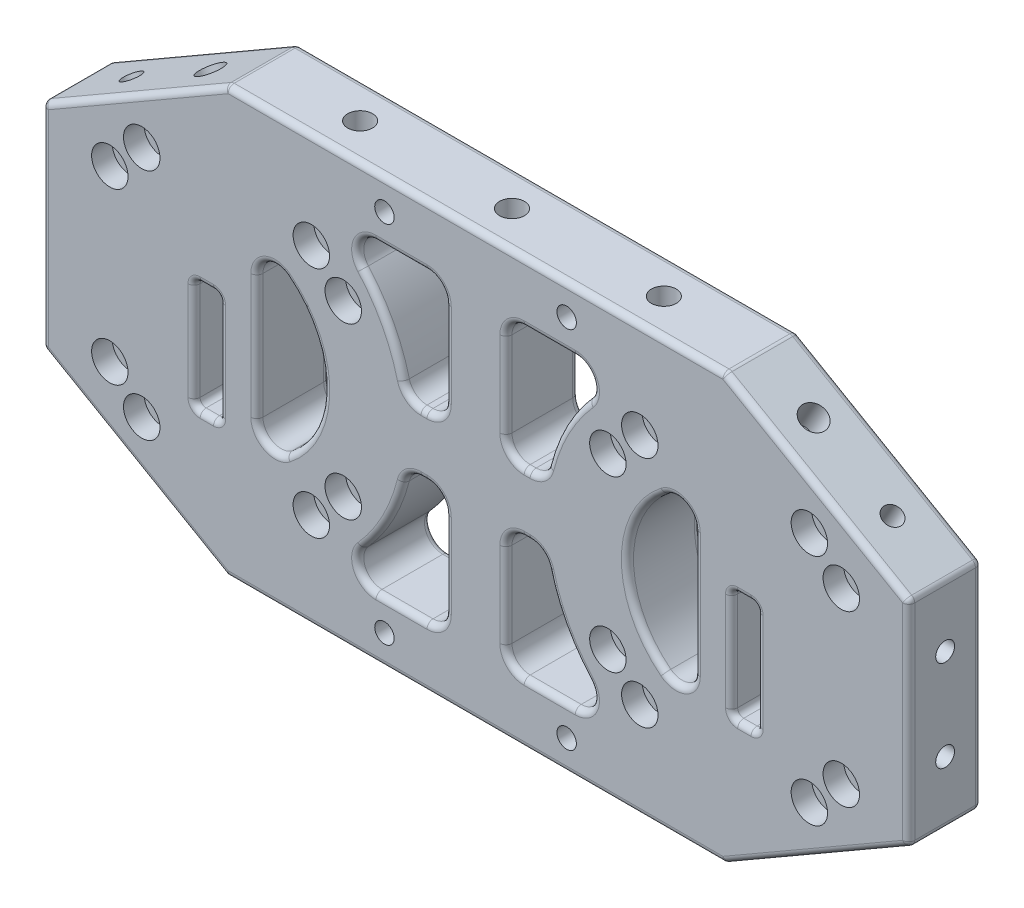
from build123d import *

# Parameters (mm, degrees)
SKETCH_1_W                   = 4.2
SKETCH_1_H                   = 18.2
EXTRUDE_1_DEPTH              = 12
FILLET_2_R                   = 3
SKETCH_2_R                   = 1.55
CUT_EXTRUDE_1_DEPTH          = 5
SKETCH_3_R                   = 1.55
CUT_EXTRUDE_2_DEPTH          = 5
SKETCH_4_R                   = 1.55
CUT_EXTRUDE_3_DEPTH          = 5
SKETCH_5_R                   = 1.55
CUT_EXTRUDE_4_DEPTH          = 5
SKETCH_6_R                   = 1.55
CUT_EXTRUDE_5_DEPTH          = 5
SKETCH_7_R                   = 2.05
CUT_EXTRUDE_6_DEPTH          = 5
CUT_EXTRUDE_START            = -5
SKETCH_8_R                   = 2.05
CUT_EXTRUDE_7_DEPTH          = 5
SKETCH_9_R                   = 1.55
CUT_EXTRUDE_8_DEPTH          = 5
SKETCH_10_R                  = 2.05
CUT_EXTRUDE_9_DEPTH          = 5
SKETCH_11_R                  = 2.05
CUT_EXTRUDE_10_DEPTH         = 5
FILLET_3_R                   = 1
HOLE_WIZARD_M3_1_D           = 3.2
HOLE_WIZARD_M3_1_CBORE_D     = 6
HOLE_WIZARD_M3_1_CBORE_DEPTH = 3.4
HOLE_WIZARD_M3_2_D           = 3.2
HOLE_WIZARD_M3_2_CBORE_D     = 6
HOLE_WIZARD_M3_2_CBORE_DEPTH = 3.4


with BuildPart() as part:
    # 草图1 → 凸台-拉伸1 (new body)
    with BuildSketch(Plane.XY):
        Polygon((0, 0), (41, 0), (41, 70), (0, 70), (-30.310889132, 52.5), (-30.310889132, 17.5), align=None)
        with BuildLine():
            Line((36, 40), (36, 60))
            Line((36, 60), (16.583123952, 60))
            ThreePointArc((16.583123952, 60), (25.154874495, 51.347241025), (29.580398915, 40))
            Line((29.580398915, 40), (36, 40))
        make_face(mode=Mode.SUBTRACT)
        with BuildLine():
            Line((36, 30), (36, 10))
            Line((36, 10), (16.583123952, 10))
            ThreePointArc((16.583123952, 10), (25.154874495, 18.652758975), (29.580398915, 30))
            Line((29.580398915, 30), (36, 30))
        make_face(mode=Mode.SUBTRACT)
        with BuildLine():
            Line((5, 50.198684154), (5, 19.801315846))
            ThreePointArc((5, 19.801315846), (16, 35), (5, 50.198684154))
        make_face(mode=Mode.SUBTRACT)
        with Locations((-3.25, 30.5)):
            Rectangle(SKETCH_1_W, SKETCH_1_H, mode=Mode.SUBTRACT)
    extrude_1 = extrude(amount=EXTRUDE_1_DEPTH)

    # 镜向2: 凸台-拉伸1 across plane
    add(extrude_1.mirror(Plane(origin=(41, 70, 12), x_dir=(0, 0, 1), z_dir=(-1, 0, 0))))

    # 圆角2
    fillet_2_edges = [part.edges().sort_by_distance(p)[0] for p in [
        (29.580398915, 40, 6),
        (36, 40, 6),
        (36, 60, 6),
        (16.583123952, 60, 6),
        (5, 19.801315846, 6),
        (5, 50.198684154, 6),
        (36, 30, 6),
        (29.580398915, 30, 6),
        (16.583123952, 10, 6),
        (36, 10, 6),
        (52.419601085, 40, 6),
        (65.416876048, 60, 6),
        (46, 60, 6),
        (46, 40, 6),
        (77, 19.801315846, 6),
        (77, 50.198684154, 6),
        (46, 30, 6),
        (46, 10, 6),
        (65.416876048, 10, 6),
        (52.419601085, 30, 6),
    ]]
    fillet(fillet_2_edges, radius=FILLET_2_R)

    # 草图2 → 切除-拉伸1 (cut)
    with BuildSketch(Plane(origin=(-30.310889132, 52.5, 0), x_dir=(0.866025403784438, 0.5000000000000012, 0), z_dir=(-0.5000000000000011, 0.8660254037844379, 0))):
        with Locations(Location((10, -6, 0), (0, 0, 180))):
            Circle(SKETCH_2_R)
        with Locations(Location((25, -6, 0), (0, 0, 180))):
            Circle(SKETCH_2_R)
    extrude(amount=-CUT_EXTRUDE_1_DEPTH, mode=Mode.SUBTRACT)

    # 草图3 → 切除-拉伸2 (cut)
    with BuildSketch(Plane(origin=(50.810889132, 88.007041555, 0), x_dir=(0.866025403784438, -0.5000000000000012, 0), z_dir=(0.5000000000000011, 0.8660254037844379, 0))):
        with Locations(Location((61.01408311, -6, 0), (0, 0, 180))):
            Circle(SKETCH_3_R)
        with Locations(Location((46.01408311, -6, 0), (0, 0, 180))):
            Circle(SKETCH_3_R)
    extrude(amount=-CUT_EXTRUDE_2_DEPTH, mode=Mode.SUBTRACT)

    # 草图4 → 切除-拉伸3 (cut)
    with BuildSketch(Plane(origin=(0, 0, 0), x_dir=(0.8660254037844397, -0.4999999999999982, 0), z_dir=(-0.4999999999999983, -0.8660254037844398, 0))):
        with Locations((-10, 6)):
            Circle(SKETCH_4_R)
        with Locations((-25, 6)):
            Circle(SKETCH_4_R)
    extrude(amount=-CUT_EXTRUDE_3_DEPTH, mode=Mode.SUBTRACT)

    # 草图5 → 切除-拉伸4 (cut)
    with BuildSketch(Plane(origin=(20.5, -35.507041555, 0), x_dir=(0.8660254037844397, 0.4999999999999982, 0), z_dir=(0.4999999999999983, -0.8660254037844398, 0))):
        with Locations((81.01408311, 6)):
            Circle(SKETCH_5_R)
        with Locations((96.01408311, 6)):
            Circle(SKETCH_5_R)
    extrude(amount=-CUT_EXTRUDE_4_DEPTH, mode=Mode.SUBTRACT)

    # 草图6 → 切除-拉伸5 (cut)
    with BuildSketch(Plane(origin=(112.310889132, 0, 0), x_dir=(0, 0, -1), z_dir=(1, 0, 0))):
        with Locations(Location((-6, 42.5, 0), (0, 0, 90))):
            Circle(SKETCH_6_R)
        with Locations(Location((-6, 27.5, 0), (0, 0, 90))):
            Circle(SKETCH_6_R)
    extrude(amount=-CUT_EXTRUDE_5_DEPTH, mode=Mode.SUBTRACT)

    # 草图7 → 切除-拉伸6 (cut)
    with BuildSketch(Plane.XZ):
        with Locations((16, 6)):
            Circle(SKETCH_7_R)
        with Locations((41, 6)):
            Circle(SKETCH_7_R)
        with Locations((66, 6)):
            Circle(SKETCH_7_R)
    extrude(amount=-CUT_EXTRUDE_6_DEPTH, mode=Mode.SUBTRACT)

    # 草图8 → 切除-拉伸7 (cut)
    with BuildSketch(Plane(origin=(0, 70, 0), x_dir=(1, 0, 0), z_dir=(0, 1, 0)).offset(CUT_EXTRUDE_START)):
        with Locations((41, -6)):
            Circle(SKETCH_8_R)
        with Locations((66, -6)):
            Circle(SKETCH_8_R)
        with Locations((16, -6)):
            Circle(SKETCH_8_R)
    extrude(amount=CUT_EXTRUDE_7_DEPTH, mode=Mode.SUBTRACT)

    # 草图9 → 切除-拉伸8 (cut)
    with BuildSketch(Plane.ZY.offset(30.310889132).offset(CUT_EXTRUDE_START)):
        with Locations(Location((6, 42.5, 0), (0, 0, 90))):
            Circle(SKETCH_9_R)
        with Locations(Location((6, 27.5, 0), (0, 0, 90))):
            Circle(SKETCH_9_R)
    extrude(amount=CUT_EXTRUDE_8_DEPTH, mode=Mode.SUBTRACT)

    # 草图10 → 切除-拉伸9 (cut)
    with BuildSketch(Plane(origin=(-30.310889132, 52.5, 0), x_dir=(0.866025403784438, 0.5000000000000012, 0), z_dir=(-0.5000000000000011, 0.8660254037844379, 0))):
        with Locations(Location((25, -6, 0), (0, 0, 180))):
            Circle(SKETCH_10_R)
    extrude(amount=-CUT_EXTRUDE_9_DEPTH, mode=Mode.SUBTRACT)

    # 草图11 → 切除-拉伸10 (cut)
    with BuildSketch(Plane(origin=(50.810889132, 88.007041555, 0), x_dir=(0.866025403784438, -0.5000000000000012, 0), z_dir=(0.5000000000000011, 0.8660254037844379, 0))):
        with Locations(Location((46.01408311, -6, 0), (0, 0, 180))):
            Circle(SKETCH_11_R)
    extrude(amount=-CUT_EXTRUDE_10_DEPTH, mode=Mode.SUBTRACT)

    # 圆角3
    fillet_3_edges = [part.edges().sort_by_distance(p)[0] for p in [
        (-30.310889132, 17.5, 6),
        (-30.310889132, 52.5, 6),
        (0, 70, 6),
        (0, 0, 6),
        (66, 35, 0),
        (66, 35, 12),
        (77, 35, 0),
        (77, 35, 12),
        (5, 35, 0),
        (5, 35, 12),
        (16, 35, 0),
        (16, 35, 12),
        (36, 20, 0),
        (36, 20, 12),
        (32.507810594, 30, 0),
        (32.507810594, 30, 12),
        (28.798373876, 10, 0),
        (28.798373876, 10, 12),
        (26.508069553, 20.952856213, 0),
        (26.508069553, 20.952856213, 12),
        (53.201626124, 10, 0),
        (53.201626124, 10, 12),
        (55.491930447, 20.952856213, 0),
        (55.491930447, 20.952856213, 12),
        (49.492189406, 30, 0),
        (49.492189406, 30, 12),
        (46, 20, 0),
        (46, 20, 12),
        (46, 50, 0),
        (46, 50, 12),
        (49.492189406, 40, 0),
        (49.492189406, 40, 12),
        (53.201626124, 60, 0),
        (53.201626124, 60, 12),
        (55.491930447, 49.047143787, 0),
        (55.491930447, 49.047143787, 12),
        (26.508069553, 49.047143787, 0),
        (26.508069553, 49.047143787, 12),
        (32.507810594, 40, 0),
        (32.507810594, 40, 12),
        (28.798373876, 60, 0),
        (28.798373876, 60, 12),
        (36, 50, 0),
        (36, 50, 12),
        (75.315587029, 22.056898131, 0),
        (41, 70, 12),
        (75.315587029, 22.056898131, 12),
        (75.315587029, 47.943101869, 0),
        (75.315587029, 47.943101869, 12),
        (6.684412971, 22.056898131, 0),
        (6.684412971, 22.056898131, 12),
        (6.684412971, 47.943101869, 0),
        (6.684412971, 47.943101869, 12),
        (35.121320344, 29.121320344, 0),
        (35.121320344, 29.121320344, 12),
        (35.121320344, 10.878679656, 0),
        (35.121320344, 10.878679656, 12),
        (21.858134965, 11.775255129, 0),
        (21.858134965, 11.775255129, 12),
        (30.169248822, 29.364510328, 0),
        (30.169248822, 29.364510328, 12),
        (60.141865035, 11.775255129, 0),
        (60.141865035, 11.775255129, 12),
        (51.830751178, 29.364510328, 0),
        (51.830751178, 29.364510328, 12),
        (46.878679656, 29.121320344, 0),
        (46.878679656, 29.121320344, 12),
        (46.878679656, 10.878679656, 0),
        (46.878679656, 10.878679656, 12),
        (46.878679656, 40.878679656, 0),
        (46.878679656, 40.878679656, 12),
        (46.878679656, 59.121320344, 0),
        (46.878679656, 59.121320344, 12),
        (60.141865035, 58.224744871, 0),
        (60.141865035, 58.224744871, 12),
        (51.830751178, 40.635489672, 0),
        (51.830751178, 40.635489672, 12),
        (30.169248822, 40.635489672, 0),
        (30.169248822, 40.635489672, 12),
        (21.858134965, 58.224744871, 0),
        (21.858134965, 58.224744871, 12),
        (35.121320344, 40.878679656, 0),
        (35.121320344, 40.878679656, 12),
        (35.121320344, 59.121320344, 0),
        (35.121320344, 59.121320344, 12),
        (-5.35, 30.5, 0),
        (-5.35, 39.6, 6),
        (-3.25, 21.4, 0),
        (-5.35, 21.4, 6),
        (-1.15, 30.5, 0),
        (-15.155444566, 61.25, 12),
        (-1.15, 21.4, 6),
        (-3.25, 39.6, 0),
        (-1.15, 39.6, 6),
        (-5.35, 30.5, 12),
        (-3.25, 21.4, 12),
        (-1.15, 30.5, 12),
        (-3.25, 39.6, 12),
        (-30.310889132, 35, 12),
        (-15.155444566, 8.75, 12),
        (-30.310889132, 35, 0),
        (-15.155444566, 61.25, 0),
        (97.155444566, 8.75, 12),
        (82, 0, 6),
        (112.310889132, 35, 12),
        (112.310889132, 17.5, 6),
        (97.155444566, 61.25, 12),
        (112.310889132, 52.5, 6),
        (82, 70, 6),
        (41, 70, 0),
        (85.25, 39.6, 12),
        (87.35, 30.5, 12),
        (85.25, 21.4, 12),
        (83.15, 30.5, 12),
        (97.155444566, 8.75, 0),
        (97.155444566, 61.25, 0),
        (112.310889132, 35, 0),
        (87.35, 30.5, 0),
        (87.35, 39.6, 6),
        (85.25, 39.6, 0),
        (83.15, 39.6, 6),
        (83.15, 30.5, 0),
        (83.15, 21.4, 6),
        (85.25, 21.4, 0),
        (87.35, 21.4, 6),
        (41, 0, 0),
        (-15.155444566, 8.75, 0),
        (41, 0, 12),
    ]]
    fillet(fillet_3_edges, radius=FILLET_3_R)

    # M3 六角圆柱头螺钉的柱形沉头孔1 (through all)
    with Locations(Plane.XY.offset(12)):
        with Locations((62.785846384, 48.959899742), (-19.214153616, 21.040100258), (-13.959899742, 15.785846384), (62.785846384, 21.040100258), (68.040100258, 15.785846384), (95.959899742, 15.785846384), (-13.959899742, 54.214153616), (-19.214153616, 48.959899742), (19.214153616, 48.959899742), (13.959899742, 54.214153616), (13.959899742, 15.785846384), (19.214153616, 21.040100258), (101.214153616, 21.040100258), (101.214153616, 48.959899742), (95.959899742, 54.214153616), (68.040100258, 54.214153616)):
            CounterBoreHole(HOLE_WIZARD_M3_1_D / 2, HOLE_WIZARD_M3_1_CBORE_D / 2, HOLE_WIZARD_M3_1_CBORE_DEPTH)

    # M3 六角圆柱头螺钉的柱形沉头孔2 (through all)
    with Locations(Plane(origin=(0, 0, 0), x_dir=(-1, 0, 0), z_dir=(0, 0, -1))):
        with Locations((-26, 65), (-56, 65), (-56, 5), (-26, 5)):
            CounterBoreHole(HOLE_WIZARD_M3_2_D / 2, HOLE_WIZARD_M3_2_CBORE_D / 2, HOLE_WIZARD_M3_2_CBORE_DEPTH)


solid = part.part
